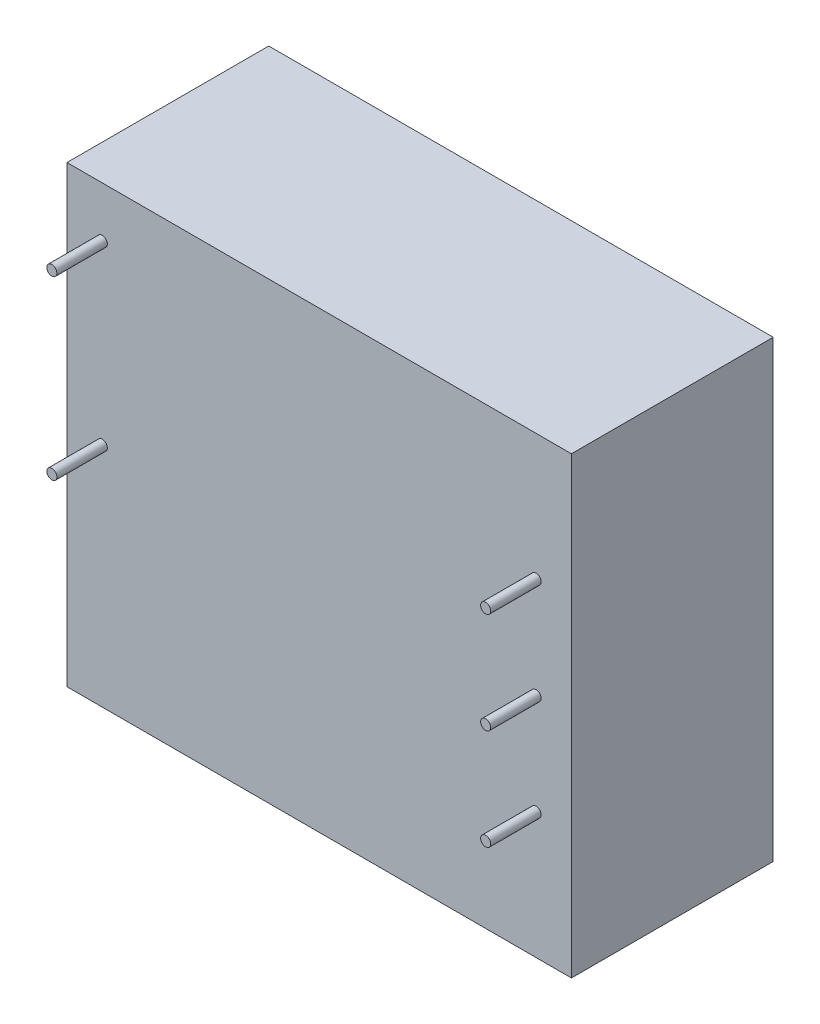
from build123d import *

# Parameters (mm, degrees)
SKETCH_1_W      = 50
SKETCH_1_H      = 45
EXTRUDE_1_DEPTH = 20
SKETCH_2_R      = 0.5
EXTRUDE_2_DEPTH = 5


with BuildPart() as part:
    # Эскиз1 → Вытянуть1 (new body)
    with BuildSketch(Plane.XY):
        Rectangle(SKETCH_1_W, SKETCH_1_H)
    extrude(amount=EXTRUDE_1_DEPTH)

    # Эскиз2 → Вытянуть2 (add)
    with BuildSketch(Plane.XY.offset(20)):
        with Locations(Location((-21.5, 17.5, 0), (0, 0, 180))):
            Circle(SKETCH_2_R)
        with Locations(Location((-21.5, 0, 0), (0, 0, 180))):
            Circle(SKETCH_2_R)
        with Locations(Location((21.5, 0, 0), (0, 0, 180))):
            Circle(SKETCH_2_R)
        with Locations(Location((21.5, 10, 0), (0, 0, 180))):
            Circle(SKETCH_2_R)
        with Locations(Location((21.5, -10, 0), (0, 0, 180))):
            Circle(SKETCH_2_R)
    extrude(amount=EXTRUDE_2_DEPTH)


solid = part.part
